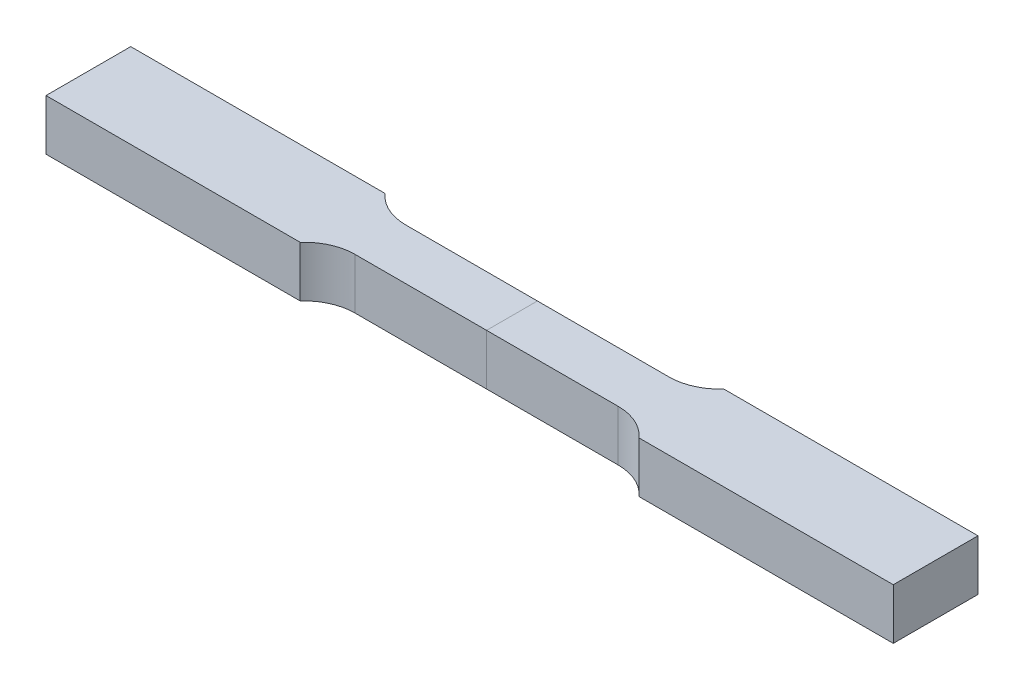
from build123d import *

# Parameters (mm, degrees)
BOSS_EXTRUDE1_DEPTH = 6


with BuildPart() as part:
    # Sketch1 → Boss-Extrude1 (new body)
    with BuildSketch(Plane(origin=(0, 0, 0), x_dir=(1, 0, 0), z_dir=(0, 1, 0))):
        with BuildLine():
            Line((0, -3), (0, 3))
            Line((0, 3), (-15.527864045, 3))
            ThreePointArc((-15.527864045, 3), (-17.977353788, 3.522774425), (-20, 5))
            Line((-20, 5), (-50, 5))
            Line((-50, 5), (-50, -5))
            Line((-50, -5), (-20, -5))
            ThreePointArc((-20, -5), (-17.977353788, -3.522774425), (-15.527864045, -3))
            Line((-15.527864045, -3), (0, -3))
        make_face()
    extrude(amount=BOSS_EXTRUDE1_DEPTH)


with BuildPart() as body_2:
    # Mirror1: mirrored copy
    add(part.part.mirror(Plane(origin=(0, 0, 0), x_dir=(0, 0, 1), z_dir=(1, 0, 0))))


solid = Compound([part.part, body_2.part])
